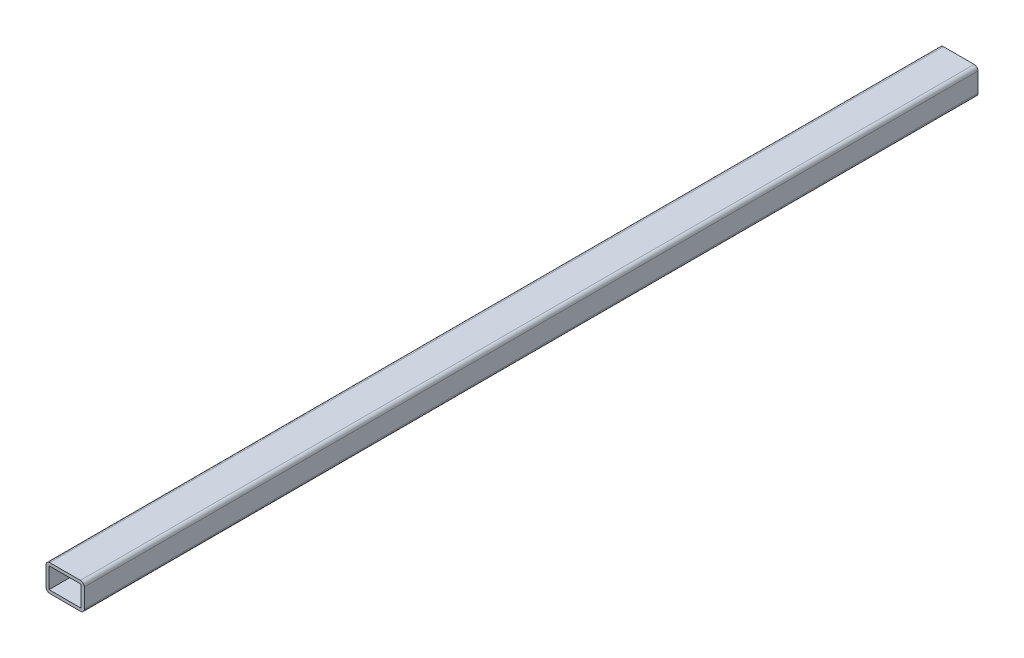
from build123d import *

# Parameters (mm, degrees)
SKETCH1_W           = 25.2
SKETCH1_H           = 16.2
BOSS_EXTRUDE1_DEPTH = 700


with BuildPart() as part:
    # Sketch1 → Boss-Extrude1 (new body)
    with BuildSketch(Plane.XY):
        with BuildLine():
            Line((3, 0), (27, 0))
            ThreePointArc((27, 0), (29.121320344, 0.878679656), (30, 3))
            Line((30, 3), (30, 18))
            ThreePointArc((30, 18), (29.121320344, 20.121320344), (27, 21))
            Line((27, 21), (3, 21))
            ThreePointArc((3, 21), (0.878679656, 20.121320344), (0, 18))
            Line((0, 18), (0, 3))
            ThreePointArc((0, 3), (0.878679656, 0.878679656), (3, 0))
        make_face()
        with Locations((15, 10.5)):
            Rectangle(SKETCH1_W, SKETCH1_H, mode=Mode.SUBTRACT)
    extrude(amount=BOSS_EXTRUDE1_DEPTH)


solid = part.part
